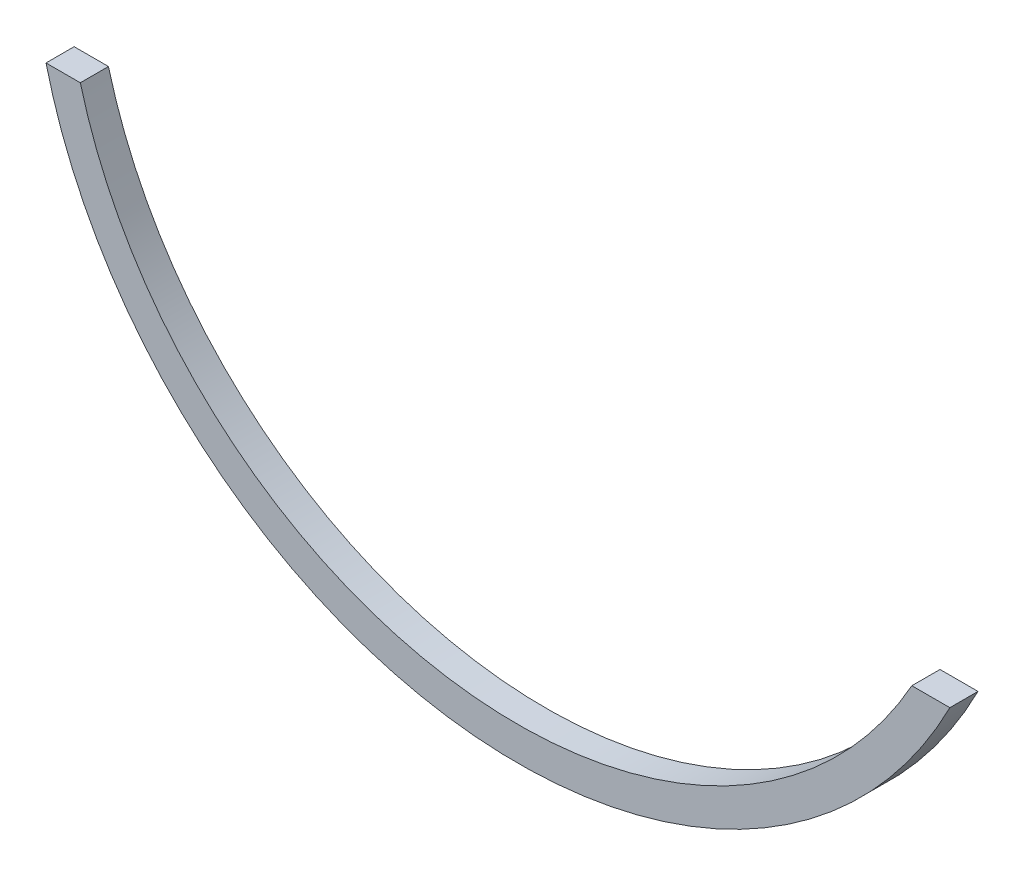
from build123d import *

# Parameters (mm, degrees)
BOSS_EXTRUDE1_DEPTH = 3.175


with BuildPart() as part:
    # Sketch1 → Boss-Extrude1 (new, symmetric)
    with BuildSketch(Plane.XY):
        with BuildLine():
            Line((88.904443084, -50), (97.475083722, -50))
            ThreePointArc((97.475083722, -50), (-12.7853662, -108.824390435), (-106.368463371, -26))
            Line((-106.368463371, -26), (-98.630624048, -26))
            ThreePointArc((-98.630624048, -26), (-12.947959261, -101.174850388), (88.904443084, -50))
        make_face()
    extrude(amount=BOSS_EXTRUDE1_DEPTH, both=True)


solid = part.part
